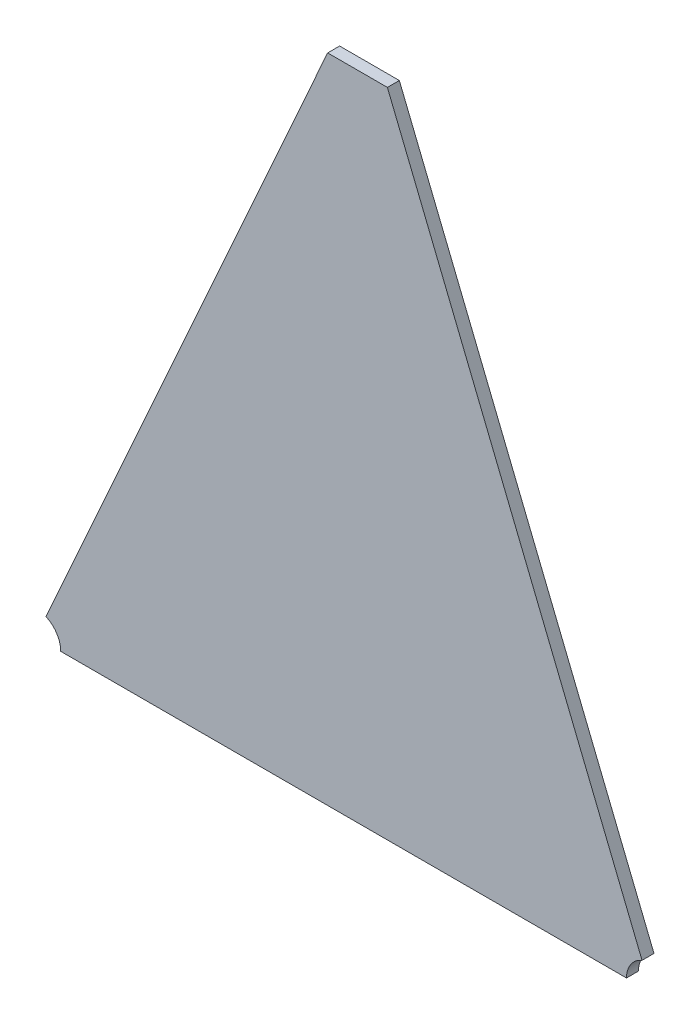
from build123d import *

# Parameters (mm, degrees)
BOSS_EXTRUDE1_DEPTH = 7.62
SKETCH5_R           = 15.875
CUT_EXTRUDE2_DEPTH  = 50.8
SKETCH6_R           = 15.875
CUT_EXTRUDE3_DEPTH  = 50.8


with BuildPart() as part:
    # Sketch2 → Boss-Extrude1 (new body)
    with BuildSketch(Plane.XY):
        Polygon((-189.740054039, 245.383385713), (-375.90852523, -170.414614287), (16.77547477, -170.414614287), (-151.640054039, 245.383385713), align=None)
    extrude(amount=BOSS_EXTRUDE1_DEPTH)

    # Sketch5 → Cut-Extrude2 (cut)
    with BuildSketch(Plane(origin=(0, 0, 0), x_dir=(-1, 0, 0), z_dir=(0, 0, -1))):
        with Locations((375.90852523, -170.414614287)):
            Circle(SKETCH5_R)
    extrude(amount=-CUT_EXTRUDE2_DEPTH, mode=Mode.SUBTRACT)

    # Sketch6 → Cut-Extrude3 (cut)
    with BuildSketch(Plane(origin=(0, 0, 0), x_dir=(-1, 0, 0), z_dir=(0, 0, -1))):
        with Locations((-16.77547477, -170.414614287)):
            Circle(SKETCH6_R)
    extrude(amount=-CUT_EXTRUDE3_DEPTH, mode=Mode.SUBTRACT)


solid = part.part
